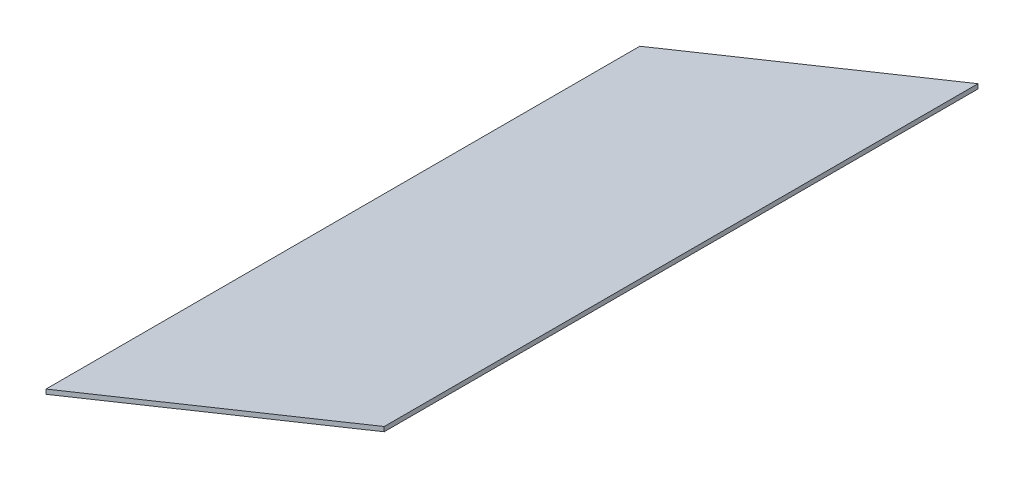
from build123d import *

# Parameters (mm, degrees)
BOSS_EXTRUDE1_DEPTH      = 350
BOSS_EXTRUDE1_DEPTH_BACK = 350


with BuildPart() as part:
    # Sketch1 → Boss-Extrude1 (new, two sides: drawn at the far end of the back side and taken through both)
    with BuildSketch(Plane.XY.offset(-BOSS_EXTRUDE1_DEPTH_BACK)):
        Polygon((0, 0), (398.689057464, 161.080835169), (398.689057464, 155.688161455), (1.873032967, -4.635919273), (0, -5.392673713), (0, -5), align=None)
    extrude(amount=BOSS_EXTRUDE1_DEPTH + BOSS_EXTRUDE1_DEPTH_BACK)


solid = part.part
